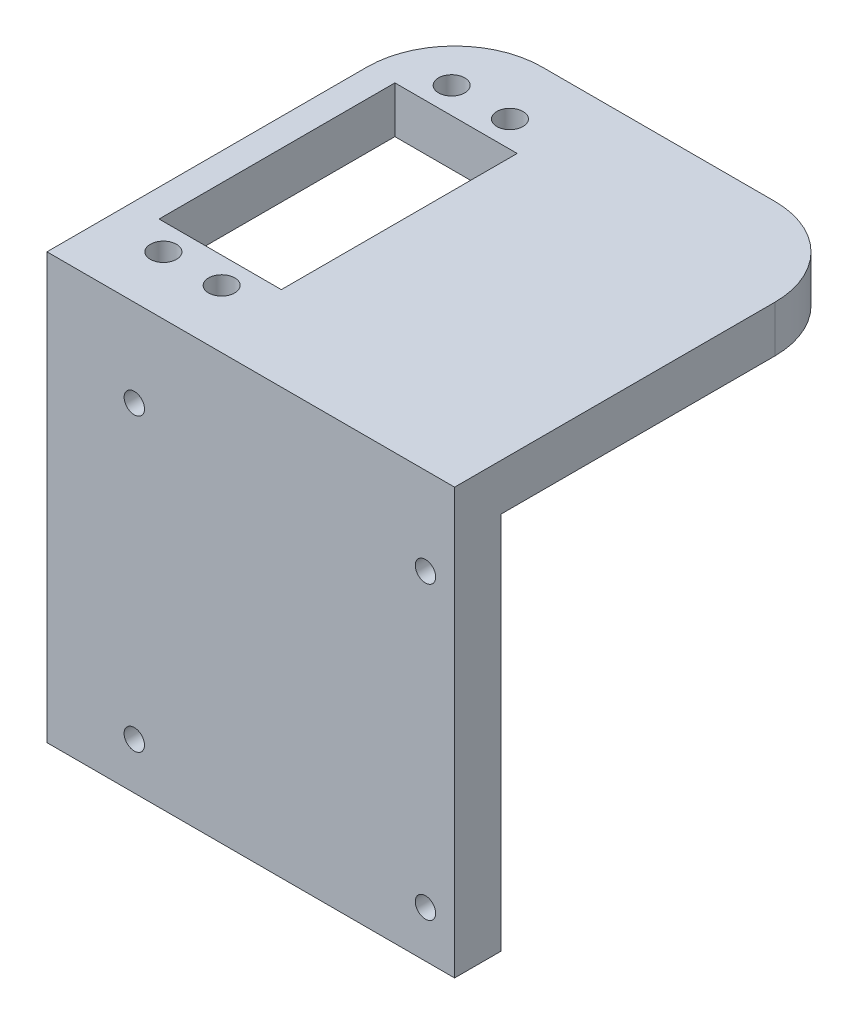
from build123d import *

# Parameters (mm, degrees)
SKETCH2_W           = 70
SKETCH2_H           = 70
BOSS_EXTRUDE1_DEPTH = 8
SKETCH4_W           = 70
SKETCH4_H           = 8
BOSS_EXTRUDE2_DEPTH = 65
SKETCH6_R           = 1.75
CUT_EXTRUDE1_DEPTH  = 10
SKETCH7_R           = 3.5
CUT_EXTRUDE2_DEPTH  = 3
SKETCH9_W           = 21
SKETCH9_H           = 40.5
CUT_EXTRUDE3_DEPTH  = 10
SKETCH10_R          = 2.25
CUT_EXTRUDE4_DEPTH  = 10
FILLET1_R           = 15
FILLET2_R           = 15


with BuildPart() as part:
    # Sketch2 → Boss-Extrude1 (new body)
    with BuildSketch(Plane(origin=(0, 0, 0), x_dir=(1, 0, 0), z_dir=(0, 1, 0))):
        with Locations((20, 2.5)):
            Rectangle(SKETCH2_W, SKETCH2_H)
    extrude(amount=BOSS_EXTRUDE1_DEPTH)

    # Sketch4 → Boss-Extrude2 (add)
    with BuildSketch(Plane(origin=(0, 0, 0), x_dir=(-1, 0, 0), z_dir=(0, -1, 0))):
        with Locations((-20, -28.5)):
            Rectangle(SKETCH4_W, SKETCH4_H)
    extrude(amount=BOSS_EXTRUDE2_DEPTH)

    # Sketch6 → Cut-Extrude1 (cut)
    with BuildSketch(Plane(origin=(0, 0, 24.5), x_dir=(-1, 0, 0), z_dir=(0, 0, -1))):
        with Locations((-50, -7)):
            Circle(SKETCH6_R)
        with Locations((0, -7)):
            Circle(SKETCH6_R)
        with Locations((-50, -57)):
            Circle(SKETCH6_R)
        with Locations((0, -57)):
            Circle(SKETCH6_R)
    extrude(amount=-CUT_EXTRUDE1_DEPTH, mode=Mode.SUBTRACT)

    # Sketch7 → Cut-Extrude2 (cut)
    with BuildSketch(Plane(origin=(0, 0, 24.5), x_dir=(-1, 0, 0), z_dir=(0, 0, -1))):
        with Locations((-50, -7)):
            Circle(SKETCH7_R)
        with Locations((0, -7)):
            Circle(SKETCH7_R)
        with Locations((0, -57)):
            Circle(SKETCH7_R)
        with Locations((-50, -57)):
            Circle(SKETCH7_R)
    extrude(amount=-CUT_EXTRUDE2_DEPTH, mode=Mode.SUBTRACT)

    # Sketch9 → Cut-Extrude3 (cut)
    with BuildSketch(Plane(origin=(0, 8, 0), x_dir=(1, 0, 0), z_dir=(0, 1, 0))):
        with Locations((0.25, 2.25)):
            Rectangle(SKETCH9_W, SKETCH9_H)
    extrude(amount=-CUT_EXTRUDE3_DEPTH, mode=Mode.SUBTRACT)

    # Sketch10 → Cut-Extrude4 (cut)
    with BuildSketch(Plane(origin=(0, 8, 0), x_dir=(1, 0, 0), z_dir=(0, 1, 0))):
        with Locations(Location((-5, 27, 0), (0, 0, 270))):
            Circle(SKETCH10_R)
        with Locations(Location((5, 27, 0), (0, 0, 270))):
            Circle(SKETCH10_R)
        with Locations(Location((-5, -22.5, 0), (0, 0, 270))):
            Circle(SKETCH10_R)
        with Locations(Location((5, -22.5, 0), (0, 0, 270))):
            Circle(SKETCH10_R)
    extrude(amount=-CUT_EXTRUDE4_DEPTH, mode=Mode.SUBTRACT)

    # Fillet1
    fillet1_edges = [part.edges().sort_by_distance(p)[0] for p in [
        (55, 4, -37.5),
    ]]
    fillet(fillet1_edges, radius=FILLET1_R)

    # Fillet2
    fillet2_edges = [part.edges().sort_by_distance(p)[0] for p in [
        (-15, 4, -37.5),
    ]]
    fillet(fillet2_edges, radius=FILLET2_R)


solid = part.part
